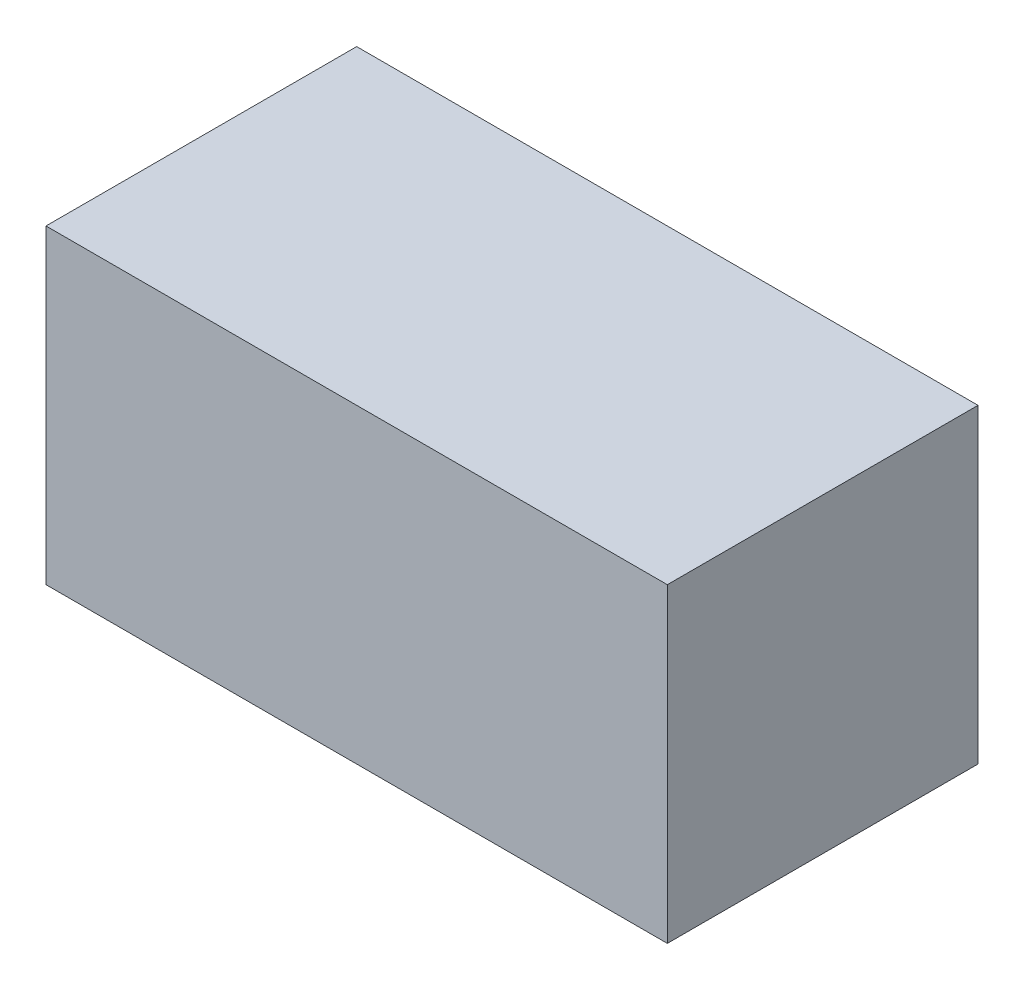
from build123d import *

# Parameters (mm, degrees)
SKETCH1_W           = 1.524
SKETCH1_H           = 0.762
BOSS_EXTRUDE1_DEPTH = 0.762


with BuildPart() as part:
    # Sketch1 → Boss-Extrude1 (new body)
    with BuildSketch(Plane(origin=(0, 0, 0), x_dir=(1, 0, 0), z_dir=(0, 1, 0))):
        with Locations((0.762, 0.381)):
            Rectangle(SKETCH1_W, SKETCH1_H)
    extrude(amount=BOSS_EXTRUDE1_DEPTH)


solid = part.part
